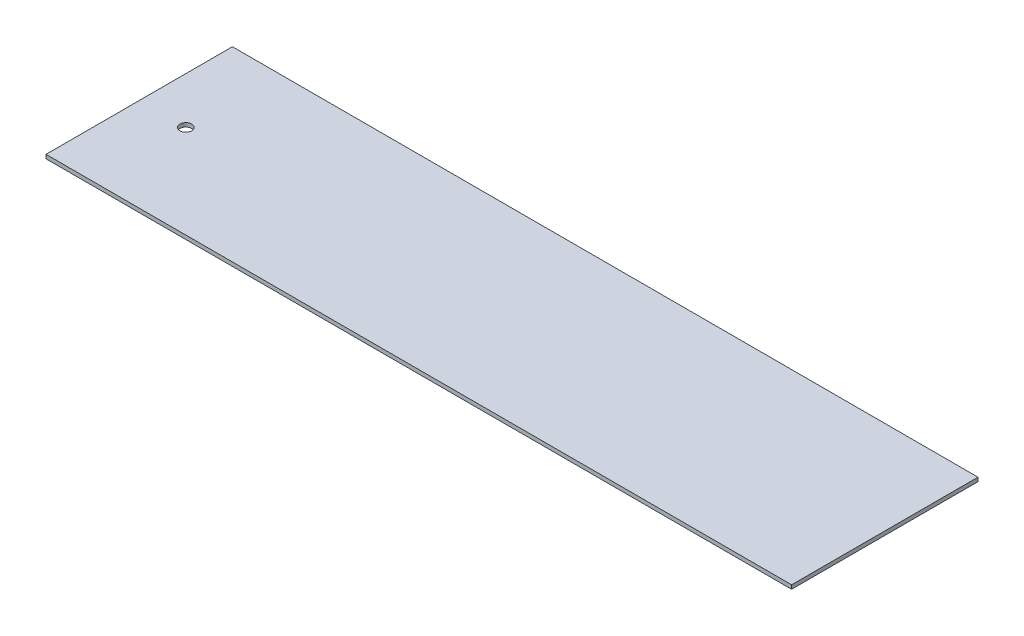
from build123d import *

# Parameters (mm, degrees)
SKETCH1_W            = 304.8
SKETCH1_H            = 76.2
ELECTRODE_BASE_DEPTH = 1.5875
SKETCH2_R            = 2.413
CUT_EXTRUDE1_DEPTH   = 315.184659327


with BuildPart() as part:
    # Sketch1 → Electrode Base (new body)
    with BuildSketch(Plane(origin=(0, 0, 0), x_dir=(1, 0, 0), z_dir=(0, 1, 0))):
        with Locations((152.4, 38.1)):
            Rectangle(SKETCH1_W, SKETCH1_H)
    extrude(amount=ELECTRODE_BASE_DEPTH)

    # Sketch2 → Cut-Extrude1 (cut, through all)
    with BuildSketch(Plane(origin=(0, 1.5875, 0), x_dir=(1, 0, 0), z_dir=(0, 1, 0))):
        with Locations(Location((19.05, 38.1, 0), (0, 0, 270))):
            Circle(SKETCH2_R)
    extrude(amount=-CUT_EXTRUDE1_DEPTH, mode=Mode.SUBTRACT)


solid = part.part
